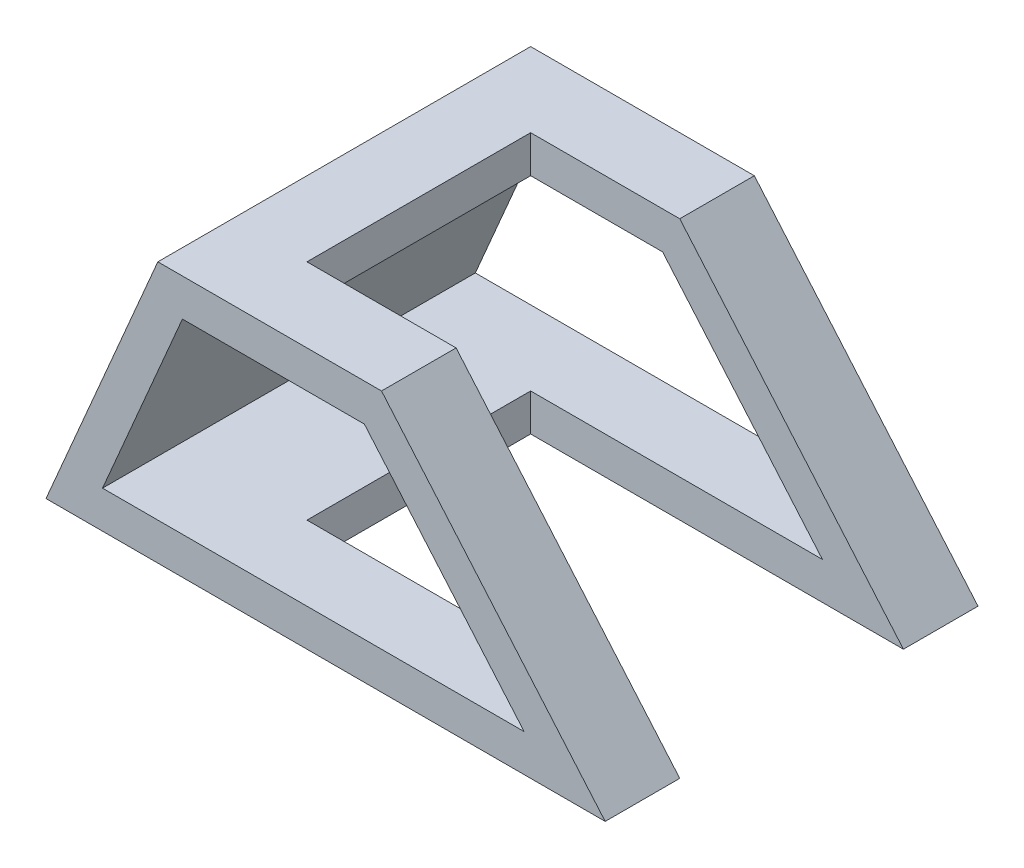
from build123d import *

# Parameters (mm, degrees)
BOSS_EXTRUDE1_DEPTH = 100
CUT_EXTRUDE1_REACH  = 145.485
SKETCH2_W           = 100
SKETCH2_H           = 60


with BuildPart() as part:
    # Sketch1 → Boss-Extrude1 (new body)
    with BuildSketch(Plane.XY):
        Polygon((-75.41879719, 0), (74.58120281, 0), (14.58120281, 70), (-45.41879719, 70), align=None)
        Polygon((9.981853585, 60), (-38.824835611, 60), (-60.253407039, 10), (52.838996442, 10), align=None, mode=Mode.SUBTRACT)
    extrude(amount=BOSS_EXTRUDE1_DEPTH)

    # Cut-Extrude1: up to this face of the body (flat: up to its plane)
    cut_extrude1_end = Plane(part.part.faces().sort_by_distance((-0.41879719, 0, 50))[0])
    # Sketch2 → Cut-Extrude1 (cut, up to the picked face)
    with BuildSketch(Plane(origin=(0, 70, 0), x_dir=(1, 0, 0), z_dir=(0, 1, 0)), mode=Mode.PRIVATE) as cut_extrude1_sk1:
        with Locations((24.58120281, -50)):
            Rectangle(SKETCH2_W, SKETCH2_H)
    cut_extrude1_tool1 = split(extrude(cut_extrude1_sk1.sketch, amount=-CUT_EXTRUDE1_REACH, mode=Mode.PRIVATE), bisect_by=cut_extrude1_end, keep=Keep.BOTH, mode=Mode.PRIVATE)
    add(cut_extrude1_tool1.solids().sort_by(Axis((24.581203, 70, 50), (0, -1, 0)))[0], mode=Mode.SUBTRACT)


solid = part.part
